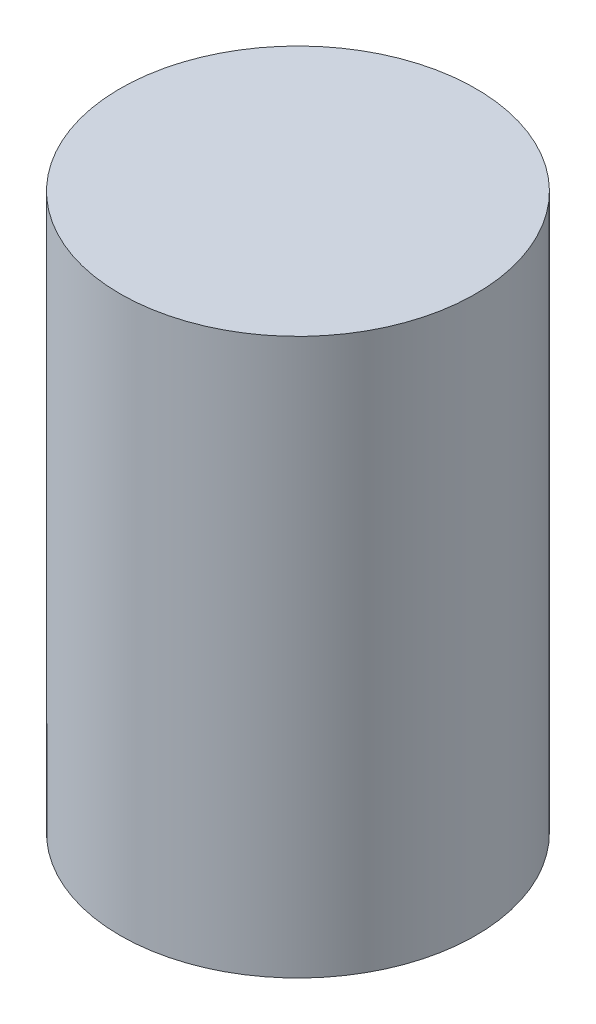
from build123d import *

# Parameters (mm, degrees)
SKETCH1_R           = 80
BOSS_EXTRUDE1_DEPTH = 250


with BuildPart() as part:
    # Sketch1 → Boss-Extrude1 (new body)
    with BuildSketch(Plane(origin=(0, 0, 0), x_dir=(1, 0, 0), z_dir=(0, 1, 0))):
        with Locations(Location((0, 0, 0), (0, 0, 270))):
            Circle(SKETCH1_R)
    extrude(amount=BOSS_EXTRUDE1_DEPTH)


solid = part.part
